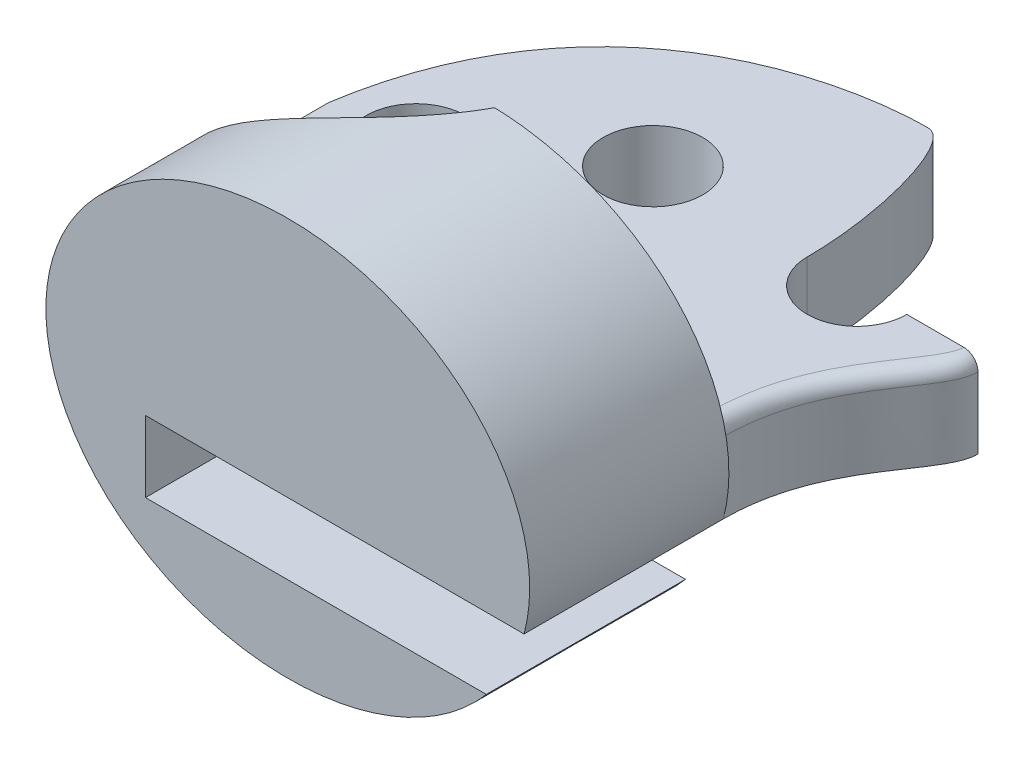
from build123d import *

# Parameters (mm, degrees)
SKETCH1_RX          = 8.5
SKETCH1_RY          = 7
BOSS_EXTRUDE1_DEPTH = 7
SKETCH3_W           = 13.302553701
SKETCH3_H           = 2.5
CUT_EXTRUDE1_DEPTH  = 7
SKETCH4_R           = 1.75
BOSS_EXTRUDE3_DEPTH = 3
CUT_EXTRUDE2_DEPTH  = 10
FILLET1_R           = 0.5
SCALE1_SCALE        = 2
SKETCH10_R          = 13
CUT_EXTRUDE3_DEPTH  = 11.904048595


with BuildPart() as part:
    # Sketch1 → Boss-Extrude1 (new body)
    with BuildSketch(Plane.XY):
        with Locations((0, 0)):
            Ellipse(SKETCH1_RX, SKETCH1_RY)
    extrude(amount=BOSS_EXTRUDE1_DEPTH)

    # Sketch3 → Cut-Extrude1 (cut)
    with BuildSketch(Plane.XY.offset(7)):
        with Locations((1.651276851, -2.75)):
            Rectangle(SKETCH3_W, SKETCH3_H)
    extrude(amount=-CUT_EXTRUDE1_DEPTH, mode=Mode.SUBTRACT)

    # Sketch4 → Boss-Extrude3 (add)
    with BuildSketch(Plane(origin=(0, -1.5, 0), x_dir=(-1, 0, 0), z_dir=(0, -1, 0))):
        with BuildLine():
            Line((-8.302553701, 6.45), (-10.802553701, 6.45))
            add(Edge.make_bspline(
                [(-8.302553701, 0), (-8.302553701, 3.575485031), (-10.802553701, 5.135257865), (-10.802553701, 6.45)],
                knots=[0, 0, 0, 0, 0.74548132, 0.74548132, 0.74548132, 0.74548132], degree=3))
            Line((-8.302553701, 0), (8.5, 0))
            add(Edge.make_bspline(
                [(8.5, 0), (8.5, 10.613387886), (0.460909778, 12.5), (-3, 12.5)],
                knots=[0, 0, 0, 0, 0.609858284, 0.609858284, 0.609858284, 0.609858284], degree=3))
            add(Edge.make_bspline(
                [(-4.802553701, 6.45), (-4.802553701, 9.055292156), (-3.876094367, 12.5), (-3, 12.5)],
                knots=[0, 0, 0, 0, 0.703518023, 0.703518023, 0.703518023, 0.703518023], degree=3))
            ThreePointArc((-4.802553701, 6.45), (-6.552553701, 4.7), (-8.302553701, 6.45))
        make_face()
        with Locations(Location((0.67, 6.5, 0), (0, 0, 180))):
            Circle(SKETCH4_R, mode=Mode.SUBTRACT)
        with Locations(Location((5.5, 3, 0), (0, 0, 180))):
            Circle(SKETCH4_R, mode=Mode.SUBTRACT)
    extrude(amount=-BOSS_EXTRUDE3_DEPTH)

    # Sketch5 → Cut-Extrude2 (cut)
    with BuildSketch(Plane(origin=(0, 0, 0), x_dir=(-1, 0, 0), z_dir=(0, 0, -1))):
        with BuildLine():
            Line((7.715910661, 2.936517276), (9.418477353, 2.936517276))
            Line((9.418477353, 2.936517276), (9.418477353, -1.069495705))
            Line((9.418477353, -1.069495705), (8.400205207, -1.069495705))
            add(Edge.make_bspline(
                [(8.400205207, -1.069495705), (8.79219322, 1.018558972), (7.715910661, 2.936517276)],
                knots=[6.129799457, 6.129799457, 6.129799457, 6.716082467, 6.716082467, 6.716082467], degree=2, weights=[1, 0.957340828, 1]))
        make_face()
    extrude(amount=CUT_EXTRUDE2_DEPTH, mode=Mode.SUBTRACT)

    # Fillet1
    fillet1_edges = [part.edges().sort_by_distance(p)[0] for p in [
        (9.151569491, 1.5, -3.377856468),
    ]]
    fillet(fillet1_edges, radius=FILLET1_R)


with BuildPart() as part_1:
    # Scale1: scaled about (-0.04579055, 0.403952777, 1.092664481)
    add(part.part.scale(SCALE1_SCALE).moved(Location((0.04579055, -0.403952777, -1.092664481))))

    # Sketch10 → Cut-Extrude3 (cut)
    with BuildSketch(Plane(origin=(0, 14.5, 0), x_dir=(-1, 0, 0), z_dir=(0, -1, 0))):
        with Locations((10.954106998, 7.092815549)):
            Circle(SKETCH10_R)
    extrude(amount=CUT_EXTRUDE3_DEPTH, mode=Mode.SUBTRACT)


solid = part_1.part
